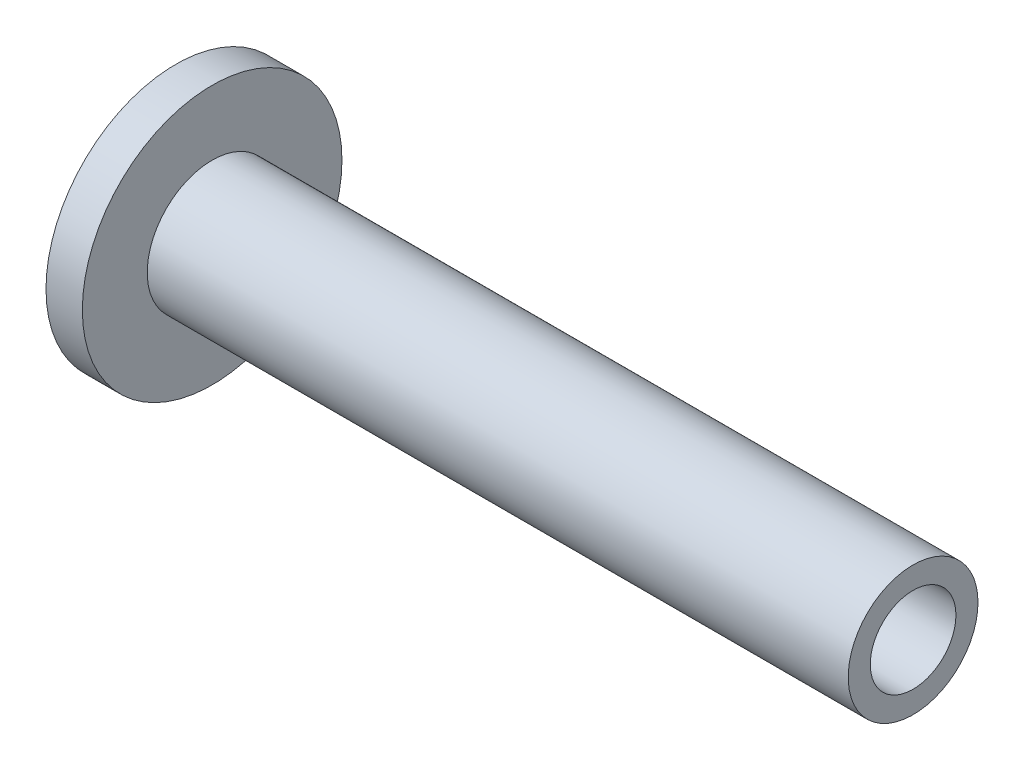
from build123d import *

# Parameters (mm, degrees)
SKETCH_1_R             = 5
EXTRUDE_1_DEPTH        = 1.9
SKETCH_2_R             = 2.5
EXTRUDE_2_DEPTH        = 27
HOLE_WIZARD_M4_1_D     = 3.3
HOLE_WIZARD_M4_1_DEPTH = 10.1
HOLE_WIZARD_M4_1_TIP   = 0.991420021
CHAMFER_1_SIZE         = 0.5
CHAMFER_1_SIZE2        = 0.866025404


with BuildPart() as part:
    # 草图1 → 凸台-拉伸1 (new body)
    with BuildSketch(Plane(origin=(0, 0, 0), x_dir=(0, 0, -1), z_dir=(1, 0, 0))):
        with Locations(Location((0, 0, 0), (0, 0, 180))):
            Circle(SKETCH_1_R)
    extrude(amount=EXTRUDE_1_DEPTH)

    # 草图2 → 凸台-拉伸2 (add)
    with BuildSketch(Plane(origin=(1.9, 0, 0), x_dir=(0, 0, -1), z_dir=(1, 0, 0))):
        Circle(SKETCH_2_R)
    extrude(amount=EXTRUDE_2_DEPTH)

    # M4 螺纹孔1
    with Locations(Plane(origin=(28.9, 0, 0), x_dir=(0, 0, 1), z_dir=(1, 0, 0))):
        with Locations((0, 0)):
            Hole(HOLE_WIZARD_M4_1_D / 2, depth=HOLE_WIZARD_M4_1_DEPTH)
            with Locations((0, 0, -(HOLE_WIZARD_M4_1_DEPTH + HOLE_WIZARD_M4_1_TIP / 2))):  # 118° drill point
                Cone(0, HOLE_WIZARD_M4_1_D / 2, HOLE_WIZARD_M4_1_TIP, mode=Mode.SUBTRACT)

    # 倒角1
    chamfer_1_edges = [part.edges().sort_by_distance(p)[0] for p in [
        (0, 0, -5),
    ]]
    chamfer_1_side = [part.faces().sort_by_distance(p)[0] for p in [
        (0.95, 0, -5),
    ]]
    chamfer(chamfer_1_edges, length=CHAMFER_1_SIZE, length2=CHAMFER_1_SIZE2, reference=chamfer_1_side[0])


solid = part.part
